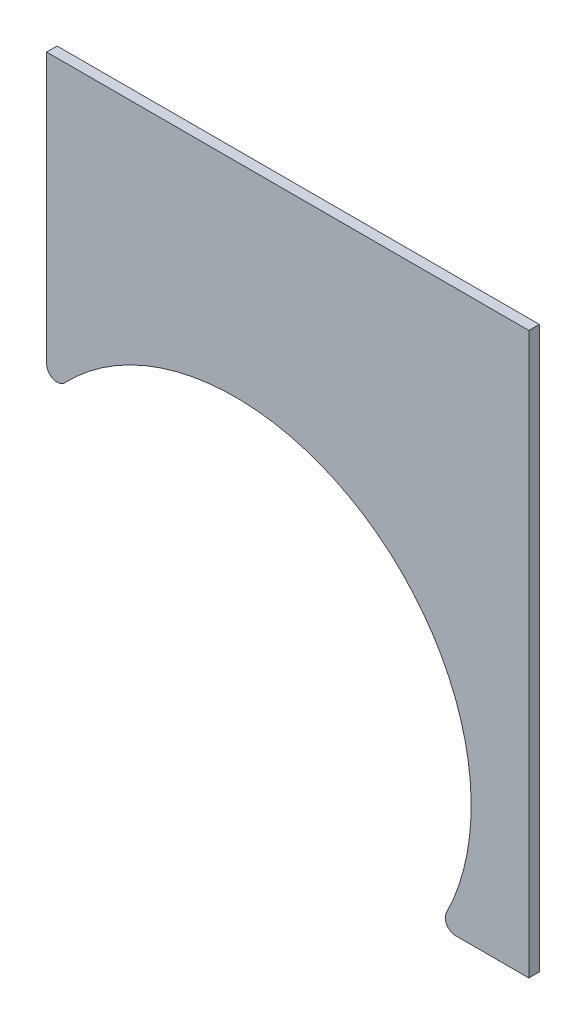
from build123d import *

# Parameters (mm, degrees)
BOSS_EXTRU_1_DEPTH = 2
CONG_1_R           = 2


with BuildPart() as part:
    # Esquisse1 → Boss.-Extru.1 (new body)
    with BuildSketch(Plane.XY):
        with BuildLine():
            Line((-36, 84), (56, 84))
            Line((56, 84), (56, -23))
            Line((56, -23), (38.678159212, -23))
            ThreePointArc((38.678159212, -23), (25.035836998, 37.392604427), (-36, 27))
            Line((-36, 27), (-36, 84))
        make_face()
    extrude(amount=BOSS_EXTRU_1_DEPTH)

    # Congé1
    cong_1_edges = [part.edges().sort_by_distance(p)[0] for p in [
        (38.678159212, -23, 1),
        (-36, 27, 1),
    ]]
    fillet(cong_1_edges, radius=CONG_1_R)


solid = part.part
